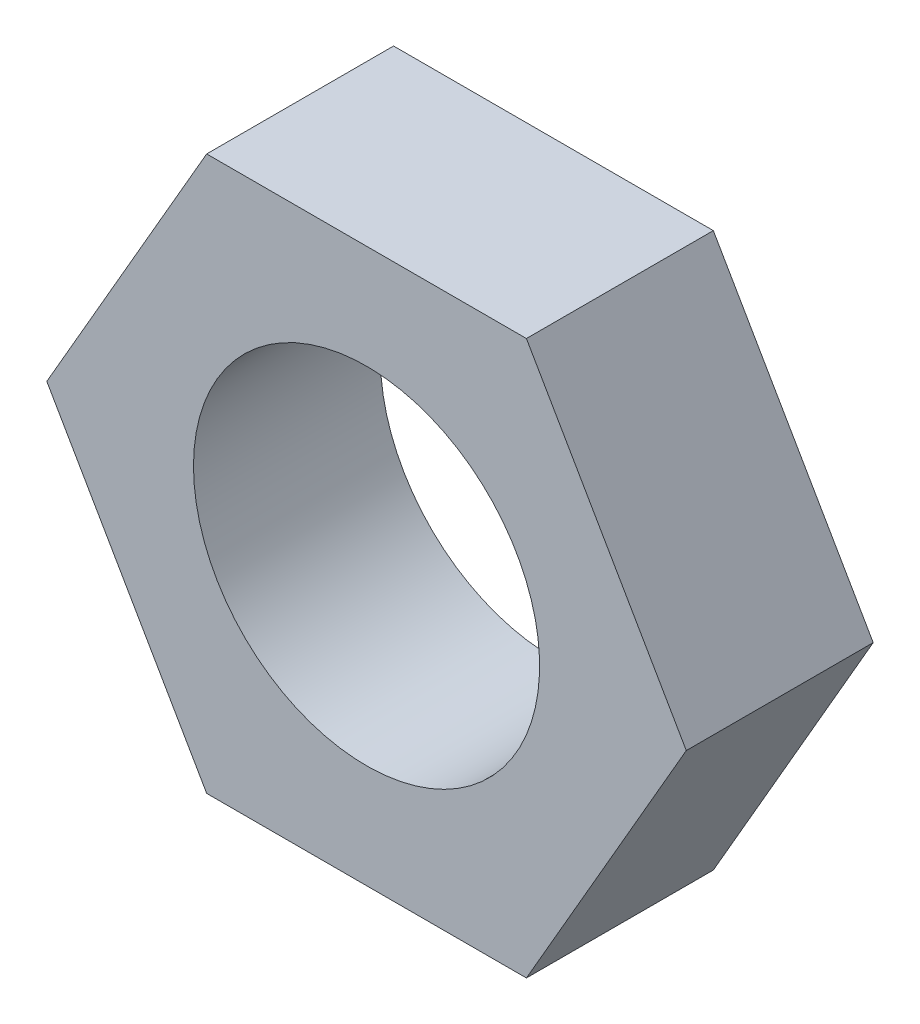
from build123d import *

# Parameters (mm, degrees)
SKETCH1_R           = 2.5
BOSS_EXTRUDE1_DEPTH = 2.7


with BuildPart() as part:
    # Sketch1 → Boss-Extrude1 (new body)
    with BuildSketch(Plane.XY.offset(2.7)):
        Polygon((-2.309401077, 4), (-4.618802154, 0), (-2.309401077, -4), (2.309401077, -4), (4.618802154, 0), (2.309401077, 4), align=None)
        with Locations(Location((0, 0, 0), (0, 0, 180))):
            Circle(SKETCH1_R, mode=Mode.SUBTRACT)
    extrude(amount=-BOSS_EXTRUDE1_DEPTH)


solid = part.part
